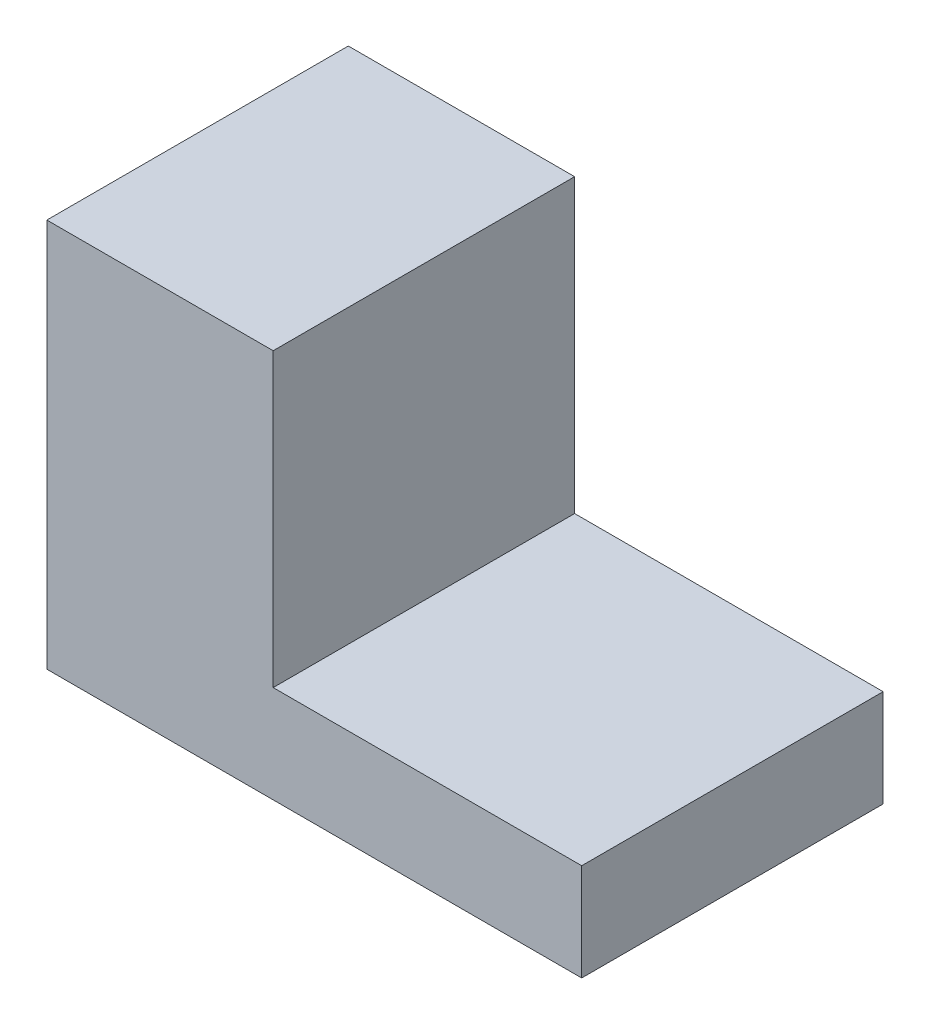
from build123d import *

# Parameters (mm, degrees)
SKETCH_1_W          = 1100
SKETCH_1_H          = 620
EXTRUDE_1_DEPTH     = 800
SKETCH_2_W          = 634.540276059
SKETCH_2_H          = 620
CUT_EXTRUDE_1_DEPTH = 600


with BuildPart() as part:
    # Эскиз1 → Бобышка-Вытянуть1 (new body)
    with BuildSketch(Plane(origin=(0, 0, 0), x_dir=(1, 0, 0), z_dir=(0, 1, 0))):
        with Locations((550, 310)):
            Rectangle(SKETCH_1_W, SKETCH_1_H)
    extrude(amount=EXTRUDE_1_DEPTH)

    # Эскиз2 → Вырез-Вытянуть1 (cut)
    with BuildSketch(Plane(origin=(0, 800, 0), x_dir=(1, 0, 0), z_dir=(0, 1, 0))):
        with Locations((782.72986197, 310)):
            Rectangle(SKETCH_2_W, SKETCH_2_H)
    extrude(amount=-CUT_EXTRUDE_1_DEPTH, mode=Mode.SUBTRACT)


solid = part.part
